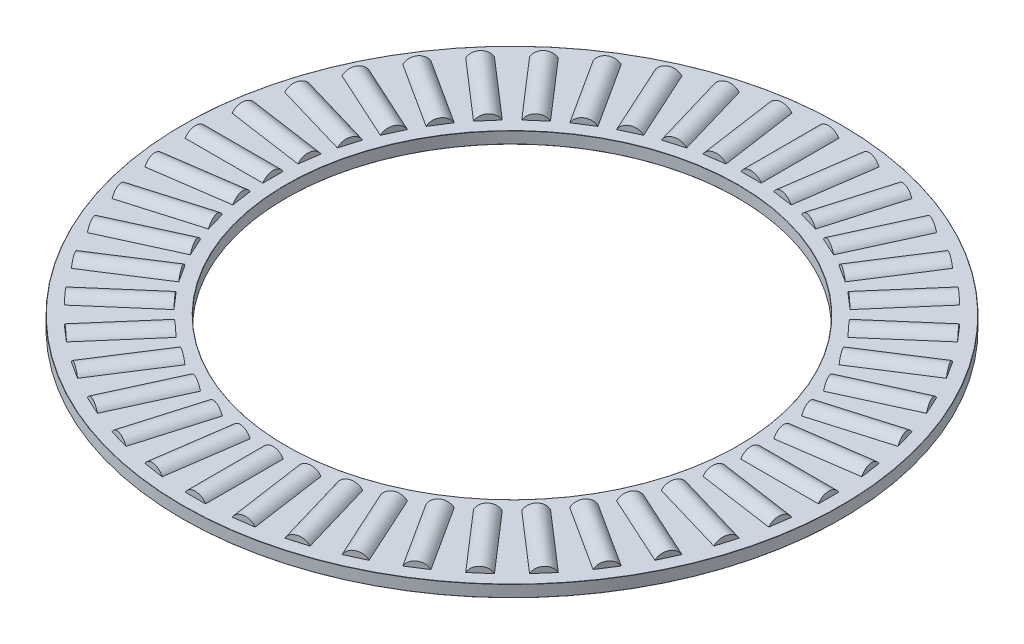
from build123d import *

# Parameters (mm, degrees)
SKETCH1_W         = 8.73125
SKETCH1_H         = 0.9921875
SKETCH3_W         = 6.5484375
SKETCH3_H         = 0.9921875
SKETCH2_W         = 6.5484375
SKETCH2_H         = 0.9921875
CIRPATTERN1_COUNT = 44
CIRPATTERN1_ANGLE = 351.818181818
CIRPATTERN2_COUNT = 44
FILLET2_R         = 0.01984375


with BuildPart() as part:
    # Sketch1 → Revolve1 (revolve)
    with BuildSketch(Plane(origin=(0, 0, 0), x_dir=(0, 0, -1), z_dir=(1, 0, 0)), mode=Mode.PRIVATE) as revolve1_sk:
        with Locations((-23.415625, 0)):
            Rectangle(SKETCH1_W, SKETCH1_H)
    revolve(revolve1_sk.sketch.rotate(Axis((0, -0.9921875, 0), (0, 1, 0)), 180), axis=Axis((0, -0.9921875, 0), (0, 1, 0)))

    # Sketch3 → Cut-Revolve1 (revolve, cut)
    with BuildSketch(Plane(origin=(0, 0, 0), x_dir=(0, 0, -1), z_dir=(1, 0, 0))):
        with Locations((-23.415625, 0.49609375)):
            Rectangle(SKETCH3_W, SKETCH3_H)
    cut_revolve1 = revolve(axis=Axis((0, 0, 26.68984375), (0, 0, -1)), mode=Mode.SUBTRACT)

    # CirPattern2: Cut-Revolve1 ×44 about axis
    cirpattern2_axis = Axis((0, 0, 0), (0, 1, 0))
    for i in range(1, CIRPATTERN2_COUNT):
        add(cut_revolve1.rotate(cirpattern2_axis, i * 360 / CIRPATTERN2_COUNT), mode=Mode.SUBTRACT)

    # Fillet2
    fillet2_edges = [part.edges().sort_by_distance(p)[0] for p in [
        (0, 0.49609375, 27.78125),
        (0, 0.49609375, 19.05),
        (0, -0.49609375, 19.05),
        (0, -0.49609375, 27.78125),
    ]]
    fillet(fillet2_edges, radius=FILLET2_R)


with BuildPart() as body_2:
    # Sketch2 → Revolve2 (revolve)
    with BuildSketch(Plane(origin=(0, 0, 0), x_dir=(0, 0, -1), z_dir=(1, 0, 0)), mode=Mode.PRIVATE) as revolve2_sk:
        with Locations((-23.415625, 0.49609375)):
            Rectangle(SKETCH2_W, SKETCH2_H)
    revolve(revolve2_sk.sketch.rotate(Axis((0, 0, 26.68984375), (0, 0, -1)), 90), axis=Axis((0, 0, 26.68984375), (0, 0, -1)))


with BuildPart() as cirpattern1_1:
    # CirPattern1: pattern copy
    add(body_2.part.rotate(Axis((0, 0.9921875, 0), (0, -1, 0)), 1 * CIRPATTERN1_ANGLE / (CIRPATTERN1_COUNT - 1)))


with BuildPart() as cirpattern1_2:
    # CirPattern1: pattern copy
    add(body_2.part.rotate(Axis((0, 0.9921875, 0), (0, -1, 0)), 2 * CIRPATTERN1_ANGLE / (CIRPATTERN1_COUNT - 1)))


with BuildPart() as cirpattern1_3:
    # CirPattern1: pattern copy
    add(body_2.part.rotate(Axis((0, 0.9921875, 0), (0, -1, 0)), 3 * CIRPATTERN1_ANGLE / (CIRPATTERN1_COUNT - 1)))


with BuildPart() as cirpattern1_4:
    # CirPattern1: pattern copy
    add(body_2.part.rotate(Axis((0, 0.9921875, 0), (0, -1, 0)), 4 * CIRPATTERN1_ANGLE / (CIRPATTERN1_COUNT - 1)))


with BuildPart() as cirpattern1_5:
    # CirPattern1: pattern copy
    add(body_2.part.rotate(Axis((0, 0.9921875, 0), (0, -1, 0)), 5 * CIRPATTERN1_ANGLE / (CIRPATTERN1_COUNT - 1)))


with BuildPart() as cirpattern1_6:
    # CirPattern1: pattern copy
    add(body_2.part.rotate(Axis((0, 0.9921875, 0), (0, -1, 0)), 6 * CIRPATTERN1_ANGLE / (CIRPATTERN1_COUNT - 1)))


with BuildPart() as cirpattern1_7:
    # CirPattern1: pattern copy
    add(body_2.part.rotate(Axis((0, 0.9921875, 0), (0, -1, 0)), 7 * CIRPATTERN1_ANGLE / (CIRPATTERN1_COUNT - 1)))


with BuildPart() as cirpattern1_8:
    # CirPattern1: pattern copy
    add(body_2.part.rotate(Axis((0, 0.9921875, 0), (0, -1, 0)), 8 * CIRPATTERN1_ANGLE / (CIRPATTERN1_COUNT - 1)))


with BuildPart() as cirpattern1_9:
    # CirPattern1: pattern copy
    add(body_2.part.rotate(Axis((0, 0.9921875, 0), (0, -1, 0)), 9 * CIRPATTERN1_ANGLE / (CIRPATTERN1_COUNT - 1)))


with BuildPart() as cirpattern1_10:
    # CirPattern1: pattern copy
    add(body_2.part.rotate(Axis((0, 0.9921875, 0), (0, -1, 0)), 10 * CIRPATTERN1_ANGLE / (CIRPATTERN1_COUNT - 1)))


with BuildPart() as cirpattern1_11:
    # CirPattern1: pattern copy
    add(body_2.part.rotate(Axis((0, 0.9921875, 0), (0, -1, 0)), 11 * CIRPATTERN1_ANGLE / (CIRPATTERN1_COUNT - 1)))


with BuildPart() as cirpattern1_12:
    # CirPattern1: pattern copy
    add(body_2.part.rotate(Axis((0, 0.9921875, 0), (0, -1, 0)), 12 * CIRPATTERN1_ANGLE / (CIRPATTERN1_COUNT - 1)))


with BuildPart() as cirpattern1_13:
    # CirPattern1: pattern copy
    add(body_2.part.rotate(Axis((0, 0.9921875, 0), (0, -1, 0)), 13 * CIRPATTERN1_ANGLE / (CIRPATTERN1_COUNT - 1)))


with BuildPart() as cirpattern1_14:
    # CirPattern1: pattern copy
    add(body_2.part.rotate(Axis((0, 0.9921875, 0), (0, -1, 0)), 14 * CIRPATTERN1_ANGLE / (CIRPATTERN1_COUNT - 1)))


with BuildPart() as cirpattern1_15:
    # CirPattern1: pattern copy
    add(body_2.part.rotate(Axis((0, 0.9921875, 0), (0, -1, 0)), 15 * CIRPATTERN1_ANGLE / (CIRPATTERN1_COUNT - 1)))


with BuildPart() as cirpattern1_16:
    # CirPattern1: pattern copy
    add(body_2.part.rotate(Axis((0, 0.9921875, 0), (0, -1, 0)), 16 * CIRPATTERN1_ANGLE / (CIRPATTERN1_COUNT - 1)))


with BuildPart() as cirpattern1_17:
    # CirPattern1: pattern copy
    add(body_2.part.rotate(Axis((0, 0.9921875, 0), (0, -1, 0)), 17 * CIRPATTERN1_ANGLE / (CIRPATTERN1_COUNT - 1)))


with BuildPart() as cirpattern1_18:
    # CirPattern1: pattern copy
    add(body_2.part.rotate(Axis((0, 0.9921875, 0), (0, -1, 0)), 18 * CIRPATTERN1_ANGLE / (CIRPATTERN1_COUNT - 1)))


with BuildPart() as cirpattern1_19:
    # CirPattern1: pattern copy
    add(body_2.part.rotate(Axis((0, 0.9921875, 0), (0, -1, 0)), 19 * CIRPATTERN1_ANGLE / (CIRPATTERN1_COUNT - 1)))


with BuildPart() as cirpattern1_20:
    # CirPattern1: pattern copy
    add(body_2.part.rotate(Axis((0, 0.9921875, 0), (0, -1, 0)), 20 * CIRPATTERN1_ANGLE / (CIRPATTERN1_COUNT - 1)))


with BuildPart() as cirpattern1_21:
    # CirPattern1: pattern copy
    add(body_2.part.rotate(Axis((0, 0.9921875, 0), (0, -1, 0)), 21 * CIRPATTERN1_ANGLE / (CIRPATTERN1_COUNT - 1)))


with BuildPart() as cirpattern1_22:
    # CirPattern1: pattern copy
    add(body_2.part.rotate(Axis((0, 0.9921875, 0), (0, -1, 0)), 22 * CIRPATTERN1_ANGLE / (CIRPATTERN1_COUNT - 1)))


with BuildPart() as cirpattern1_23:
    # CirPattern1: pattern copy
    add(body_2.part.rotate(Axis((0, 0.9921875, 0), (0, -1, 0)), 23 * CIRPATTERN1_ANGLE / (CIRPATTERN1_COUNT - 1)))


with BuildPart() as cirpattern1_24:
    # CirPattern1: pattern copy
    add(body_2.part.rotate(Axis((0, 0.9921875, 0), (0, -1, 0)), 24 * CIRPATTERN1_ANGLE / (CIRPATTERN1_COUNT - 1)))


with BuildPart() as cirpattern1_25:
    # CirPattern1: pattern copy
    add(body_2.part.rotate(Axis((0, 0.9921875, 0), (0, -1, 0)), 25 * CIRPATTERN1_ANGLE / (CIRPATTERN1_COUNT - 1)))


with BuildPart() as cirpattern1_26:
    # CirPattern1: pattern copy
    add(body_2.part.rotate(Axis((0, 0.9921875, 0), (0, -1, 0)), 26 * CIRPATTERN1_ANGLE / (CIRPATTERN1_COUNT - 1)))


with BuildPart() as cirpattern1_27:
    # CirPattern1: pattern copy
    add(body_2.part.rotate(Axis((0, 0.9921875, 0), (0, -1, 0)), 27 * CIRPATTERN1_ANGLE / (CIRPATTERN1_COUNT - 1)))


with BuildPart() as cirpattern1_28:
    # CirPattern1: pattern copy
    add(body_2.part.rotate(Axis((0, 0.9921875, 0), (0, -1, 0)), 28 * CIRPATTERN1_ANGLE / (CIRPATTERN1_COUNT - 1)))


with BuildPart() as cirpattern1_29:
    # CirPattern1: pattern copy
    add(body_2.part.rotate(Axis((0, 0.9921875, 0), (0, -1, 0)), 29 * CIRPATTERN1_ANGLE / (CIRPATTERN1_COUNT - 1)))


with BuildPart() as cirpattern1_30:
    # CirPattern1: pattern copy
    add(body_2.part.rotate(Axis((0, 0.9921875, 0), (0, -1, 0)), 30 * CIRPATTERN1_ANGLE / (CIRPATTERN1_COUNT - 1)))


with BuildPart() as cirpattern1_31:
    # CirPattern1: pattern copy
    add(body_2.part.rotate(Axis((0, 0.9921875, 0), (0, -1, 0)), 31 * CIRPATTERN1_ANGLE / (CIRPATTERN1_COUNT - 1)))


with BuildPart() as cirpattern1_32:
    # CirPattern1: pattern copy
    add(body_2.part.rotate(Axis((0, 0.9921875, 0), (0, -1, 0)), 32 * CIRPATTERN1_ANGLE / (CIRPATTERN1_COUNT - 1)))


with BuildPart() as cirpattern1_33:
    # CirPattern1: pattern copy
    add(body_2.part.rotate(Axis((0, 0.9921875, 0), (0, -1, 0)), 33 * CIRPATTERN1_ANGLE / (CIRPATTERN1_COUNT - 1)))


with BuildPart() as cirpattern1_34:
    # CirPattern1: pattern copy
    add(body_2.part.rotate(Axis((0, 0.9921875, 0), (0, -1, 0)), 34 * CIRPATTERN1_ANGLE / (CIRPATTERN1_COUNT - 1)))


with BuildPart() as cirpattern1_35:
    # CirPattern1: pattern copy
    add(body_2.part.rotate(Axis((0, 0.9921875, 0), (0, -1, 0)), 35 * CIRPATTERN1_ANGLE / (CIRPATTERN1_COUNT - 1)))


with BuildPart() as cirpattern1_36:
    # CirPattern1: pattern copy
    add(body_2.part.rotate(Axis((0, 0.9921875, 0), (0, -1, 0)), 36 * CIRPATTERN1_ANGLE / (CIRPATTERN1_COUNT - 1)))


with BuildPart() as cirpattern1_37:
    # CirPattern1: pattern copy
    add(body_2.part.rotate(Axis((0, 0.9921875, 0), (0, -1, 0)), 37 * CIRPATTERN1_ANGLE / (CIRPATTERN1_COUNT - 1)))


with BuildPart() as cirpattern1_38:
    # CirPattern1: pattern copy
    add(body_2.part.rotate(Axis((0, 0.9921875, 0), (0, -1, 0)), 38 * CIRPATTERN1_ANGLE / (CIRPATTERN1_COUNT - 1)))


with BuildPart() as cirpattern1_39:
    # CirPattern1: pattern copy
    add(body_2.part.rotate(Axis((0, 0.9921875, 0), (0, -1, 0)), 39 * CIRPATTERN1_ANGLE / (CIRPATTERN1_COUNT - 1)))


with BuildPart() as cirpattern1_40:
    # CirPattern1: pattern copy
    add(body_2.part.rotate(Axis((0, 0.9921875, 0), (0, -1, 0)), 40 * CIRPATTERN1_ANGLE / (CIRPATTERN1_COUNT - 1)))


with BuildPart() as cirpattern1_41:
    # CirPattern1: pattern copy
    add(body_2.part.rotate(Axis((0, 0.9921875, 0), (0, -1, 0)), 41 * CIRPATTERN1_ANGLE / (CIRPATTERN1_COUNT - 1)))


with BuildPart() as cirpattern1_42:
    # CirPattern1: pattern copy
    add(body_2.part.rotate(Axis((0, 0.9921875, 0), (0, -1, 0)), 42 * CIRPATTERN1_ANGLE / (CIRPATTERN1_COUNT - 1)))


with BuildPart() as cirpattern1_43:
    # CirPattern1: pattern copy
    add(body_2.part.rotate(Axis((0, 0.9921875, 0), (0, -1, 0)), 43 * CIRPATTERN1_ANGLE / (CIRPATTERN1_COUNT - 1)))


solid = Compound([part.part, body_2.part, cirpattern1_1.part, cirpattern1_2.part, cirpattern1_3.part, cirpattern1_4.part, cirpattern1_5.part, cirpattern1_6.part, cirpattern1_7.part, cirpattern1_8.part, cirpattern1_9.part, cirpattern1_10.part, cirpattern1_11.part, cirpattern1_12.part, cirpattern1_13.part, cirpattern1_14.part, cirpattern1_15.part, cirpattern1_16.part, cirpattern1_17.part, cirpattern1_18.part, cirpattern1_19.part, cirpattern1_20.part, cirpattern1_21.part, cirpattern1_22.part, cirpattern1_23.part, cirpattern1_24.part, cirpattern1_25.part, cirpattern1_26.part, cirpattern1_27.part, cirpattern1_28.part, cirpattern1_29.part, cirpattern1_30.part, cirpattern1_31.part, cirpattern1_32.part, cirpattern1_33.part, cirpattern1_34.part, cirpattern1_35.part, cirpattern1_36.part, cirpattern1_37.part, cirpattern1_38.part, cirpattern1_39.part, cirpattern1_40.part, cirpattern1_41.part, cirpattern1_42.part, cirpattern1_43.part])
